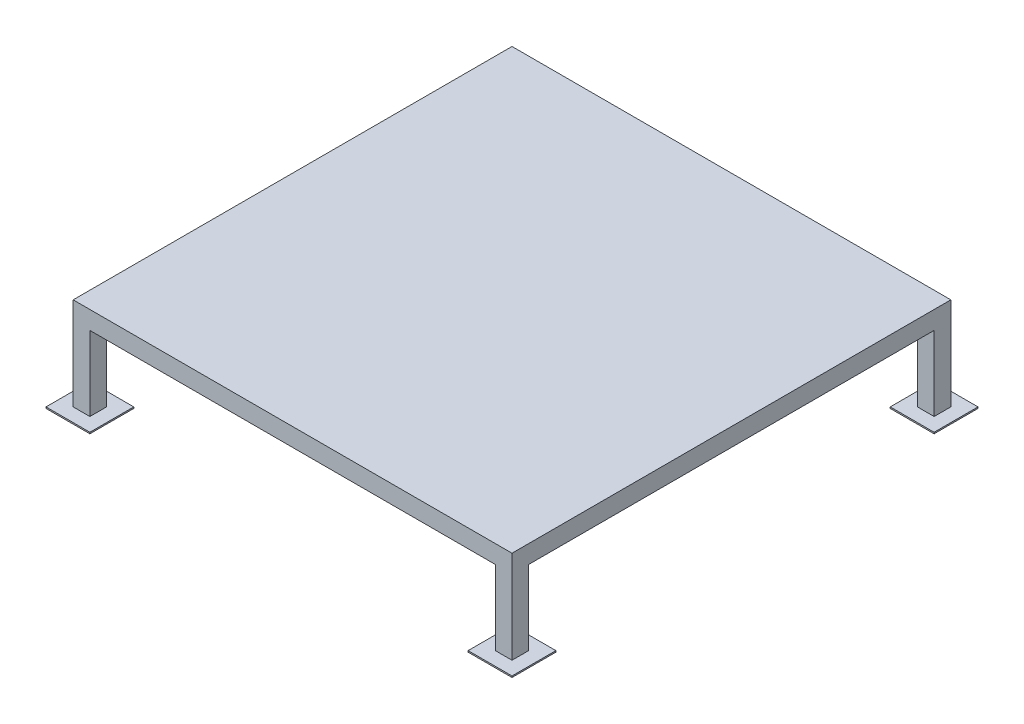
from build123d import *

# Parameters (mm, degrees)
CROQUIS1_W              = 1000
CROQUIS1_H              = 1000
SALIENTE_EXTRUIR1_DEPTH = 3.175
CROQUIS2_W              = 1000
CROQUIS2_H              = 1000
CROQUIS2_W_2            = 923.8
CROQUIS2_H_2            = 923.8
SALIENTE_EXTRUIR2_DEPTH = 38.1
CROQUIS3_W              = 38.1
CROQUIS3_H              = 38.1
SALIENTE_EXTRUIR3_DEPTH = 170
CROQUIS4_W              = 100
CROQUIS4_H              = 100
SALIENTE_EXTRUIR4_DEPTH = 3.175


with BuildPart() as part:
    # Croquis1 → Saliente-Extruir1 (new body)
    with BuildSketch(Plane(origin=(0, 0, 0), x_dir=(1, 0, 0), z_dir=(0, 1, 0))):
        Rectangle(CROQUIS1_W, CROQUIS1_H)
    extrude(amount=SALIENTE_EXTRUIR1_DEPTH)

    # Croquis2 → Saliente-Extruir2 (add)
    with BuildSketch(Plane(origin=(0, 0, 0), x_dir=(-1, 0, 0), z_dir=(0, -1, 0))):
        Rectangle(CROQUIS2_W, CROQUIS2_H)
        Rectangle(CROQUIS2_W_2, CROQUIS2_H_2, mode=Mode.SUBTRACT)
    extrude(amount=SALIENTE_EXTRUIR2_DEPTH)

    # Croquis3 → Saliente-Extruir3 (add)
    with BuildSketch(Plane.XZ.offset(38.1)):
        with Locations((480.95, 480.95)):
            Rectangle(CROQUIS3_W, CROQUIS3_H)
        with Locations((-480.95, 480.95)):
            Rectangle(CROQUIS3_W, CROQUIS3_H)
        with Locations((480.95, -480.95)):
            Rectangle(CROQUIS3_W, CROQUIS3_H)
        with Locations((-480.95, -480.95)):
            Rectangle(CROQUIS3_W, CROQUIS3_H)
    extrude(amount=SALIENTE_EXTRUIR3_DEPTH)

    # Croquis4 → Saliente-Extruir4 (add)
    with BuildSketch(Plane.XZ.offset(208.1)):
        with Locations((480.95, 480.95)):
            Rectangle(CROQUIS4_W, CROQUIS4_H)
        with Locations((-480.95, 480.95)):
            Rectangle(CROQUIS4_W, CROQUIS4_H)
        with Locations((480.95, -480.95)):
            Rectangle(CROQUIS4_W, CROQUIS4_H)
        with Locations((-480.95, -480.95)):
            Rectangle(CROQUIS4_W, CROQUIS4_H)
    extrude(amount=SALIENTE_EXTRUIR4_DEPTH)


solid = part.part
